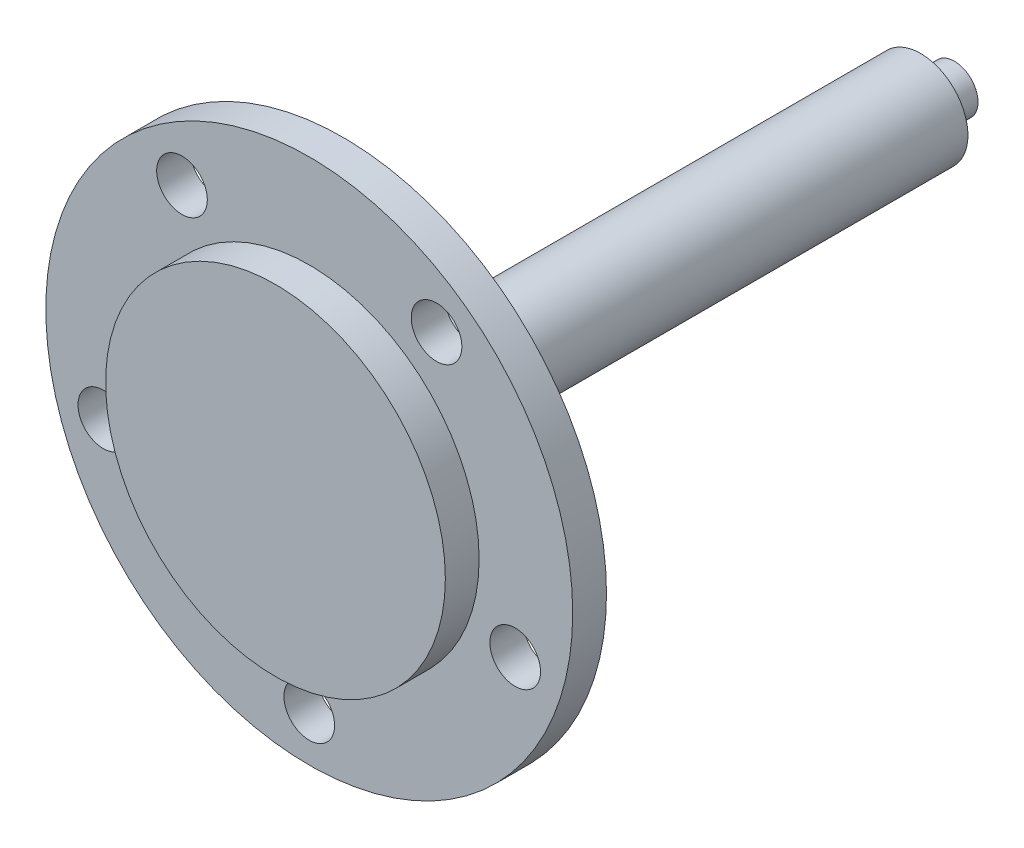
from build123d import *

# Parameters (mm, degrees)
SKETCH1_R            = 14
BOSS_EXTRUDE2_DEPTH  = 18
BOSS_EXTRUDE7_START  = 3
SKETCH8_R            = 14
BOSS_EXTRUDE7_DEPTH  = 3
SKETCH12_R           = 14
BOSS_EXTRUDE11_DEPTH = 150
SKETCH13_R           = 7
BOSS_EXTRUDE12_DEPTH = 10
SKETCH14_R           = 78
SKETCH14_R_2         = 7.5
BOSS_EXTRUDE13_DEPTH = 10
SKETCH15_R           = 50.291796038
BOSS_EXTRUDE14_DEPTH = 10


with BuildPart() as part:
    # Sketch1 → Boss-Extrude2 (new body)
    with BuildSketch(Plane.XY):
        Circle(SKETCH1_R)
    extrude(amount=BOSS_EXTRUDE2_DEPTH)

    # Sketch8 → Boss-Extrude7 (add)
    with BuildSketch(Plane(origin=(0, 0, 0), x_dir=(-1, 0, 0), z_dir=(0, 0, -1)).offset(BOSS_EXTRUDE7_START)):
        Circle(SKETCH8_R)
    extrude(amount=-BOSS_EXTRUDE7_DEPTH)

    # Sketch12 → Boss-Extrude11 (add)
    with BuildSketch(Plane.XY.offset(18)):
        with Locations(Location((0, 0, 0), (0, 0, 180))):
            Circle(SKETCH12_R)
    extrude(amount=BOSS_EXTRUDE11_DEPTH)

    # Sketch13 → Boss-Extrude12 (add)
    with BuildSketch(Plane(origin=(0, 0, -3), x_dir=(-1, 0, 0), z_dir=(0, 0, -1))):
        Circle(SKETCH13_R)
    extrude(amount=BOSS_EXTRUDE12_DEPTH)

    # Sketch14 → Boss-Extrude13 (add)
    with BuildSketch(Plane.XY.offset(168)):
        Circle(SKETCH14_R)
        with Locations((0, -64.10766693)):
            Circle(SKETCH14_R_2, mode=Mode.SUBTRACT)
        with Locations((-60.970014378, -19.810358551)):
            Circle(SKETCH14_R_2, mode=Mode.SUBTRACT)
        with Locations((-37.68154118, 51.864192016)):
            Circle(SKETCH14_R_2, mode=Mode.SUBTRACT)
        with Locations((37.68154118, 51.864192016)):
            Circle(SKETCH14_R_2, mode=Mode.SUBTRACT)
        with Locations((60.970014378, -19.810358551)):
            Circle(SKETCH14_R_2, mode=Mode.SUBTRACT)
    extrude(amount=BOSS_EXTRUDE13_DEPTH)

    # Sketch15 → Boss-Extrude14 (add)
    with BuildSketch(Plane.XY.offset(178)):
        Circle(SKETCH15_R)
    extrude(amount=BOSS_EXTRUDE14_DEPTH)


solid = part.part
